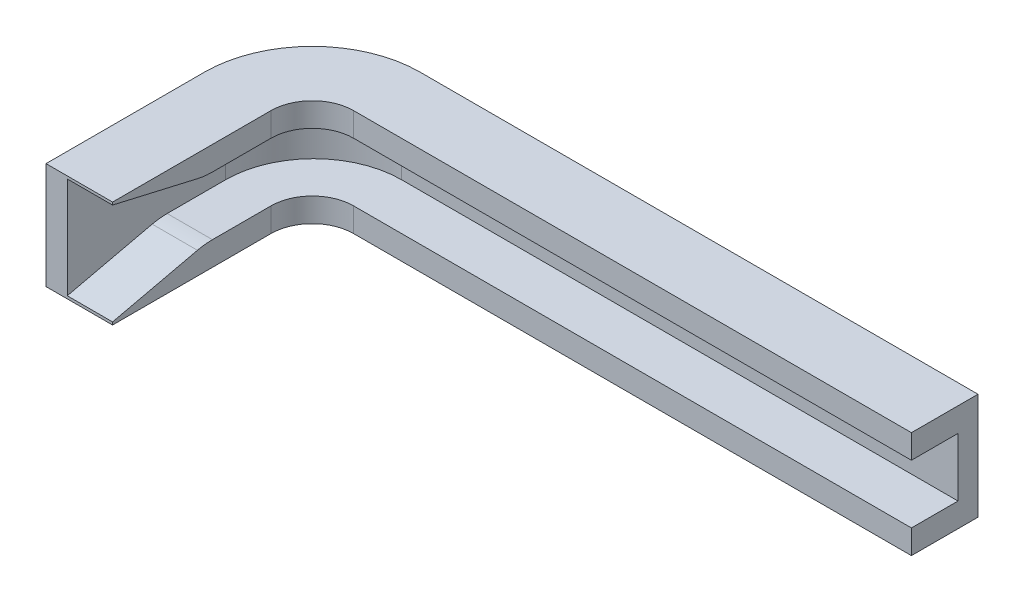
from build123d import *

# Parameters (mm, degrees)
SKETCH1_W           = 50
SKETCH1_H           = 8
BOSS_EXTRUDE1_DEPTH = 20
SKETCH2_W           = 48.4
SKETCH2_H           = 4.4
CUT_EXTRUDE1_DEPTH  = 18.5
SKETCH3_W           = 45
SKETCH3_H           = 15
CUT_EXTRUDE2_DEPTH  = 18
FILLET1_R           = 6.6
FILLET2_R           = 8.1
FILLET3_R           = 3.1
CHAMFER1_SIZE       = 1.6
CHAMFER1_SIZE2      = 6.930361399
FILLET4_R           = 5


with BuildPart() as part:
    # Sketch1 → Boss-Extrude1 (new body)
    with BuildSketch(Plane.XY):
        with Locations((25, 4)):
            Rectangle(SKETCH1_W, SKETCH1_H)
    extrude(amount=BOSS_EXTRUDE1_DEPTH)

    # Sketch2 → Cut-Extrude1 (cut)
    with BuildSketch(Plane.XY.offset(20)):
        with Locations((25.8, 4.003663633)):
            Rectangle(SKETCH2_W, SKETCH2_H)
    extrude(amount=-CUT_EXTRUDE1_DEPTH, mode=Mode.SUBTRACT)

    # Sketch3 → Cut-Extrude2 (cut)
    with BuildSketch(Plane(origin=(0, 0, 0), x_dir=(-1, 0, 0), z_dir=(0, -1, 0))):
        with Locations((-27.5, -12.5)):
            Rectangle(SKETCH3_W, SKETCH3_H)
    extrude(amount=-CUT_EXTRUDE2_DEPTH, mode=Mode.SUBTRACT)

    # Fillet1
    fillet1_edges = [part.edges().sort_by_distance(p)[0] for p in [
        (1.6, 4.003663633, 1.5),
    ]]
    fillet(fillet1_edges, radius=FILLET1_R)

    # Fillet2
    fillet2_edges = [part.edges().sort_by_distance(p)[0] for p in [
        (0, 4, 0),
    ]]
    fillet(fillet2_edges, radius=FILLET2_R)

    # Fillet3
    fillet3_edges = [part.edges().sort_by_distance(p)[0] for p in [
        (5, 7.101831816, 5),
        (5, 0.901831816, 5),
    ]]
    fillet(fillet3_edges, radius=FILLET3_R)

    # Chamfer1
    chamfer1_edges = [part.edges().sort_by_distance(p)[0] for p in [
        (3.3, 1.803663633, 20),
        (3.3, 6.203663633, 20),
    ]]
    chamfer1_side = [part.faces().sort_by_distance(p)[0] for p in [
        (2.5, 7.905660189, 20),
    ]]
    chamfer(chamfer1_edges, length=CHAMFER1_SIZE, length2=CHAMFER1_SIZE2, reference=chamfer1_side[0])

    # Fillet4
    fillet4_edges = [part.edges().sort_by_distance(p)[0] for p in [
        (3.3, 1.803663633, 13.069638601),
        (3.3, 6.203663633, 13.069638601),
    ]]
    fillet(fillet4_edges, radius=FILLET4_R)


solid = part.part
